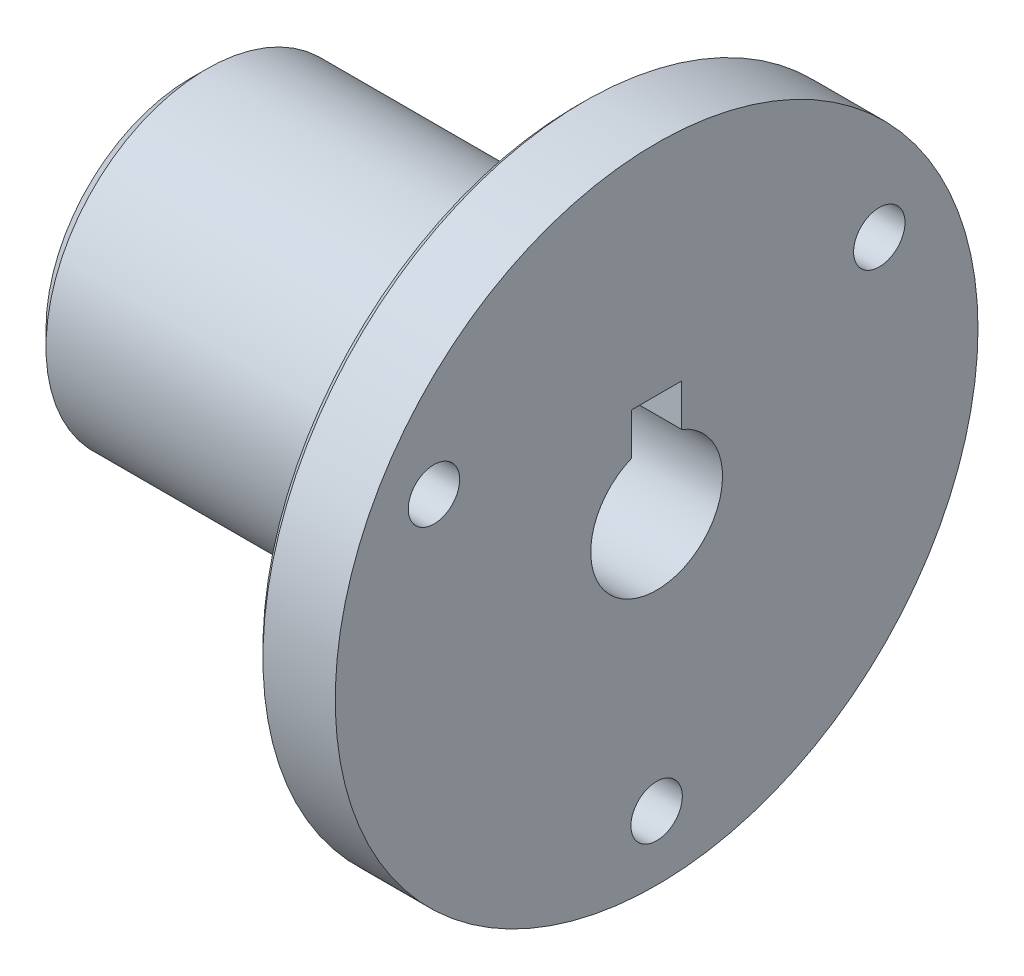
from build123d import *

# Parameters (mm, degrees)
SKETCH_1_R          = 10
EXTRUDE_1_DEPTH     = 24
SKETCH_2_R          = 20
SKETCH_2_R_2        = 1.6
EXTRUDE_2_DEPTH     = 5
CHAMFER_1_SIZE      = 0.5
CHAMFER_2_SIZE      = 1
CHAMFER_3_SIZE      = 0.5
CHAMFER_4_SIZE      = 2
CUT_EXTRUDE_1_DEPTH = 10


with BuildPart() as part:
    # 草图1 → 凸台-拉伸1 (new body)
    with BuildSketch(Plane(origin=(0, 0, 0), x_dir=(0, 0, -1), z_dir=(1, 0, 0))):
        Circle(SKETCH_1_R)
        with BuildLine():
            Line((0, 6.4), (-1.55, 6.4))
            Line((-1.55, 6.4), (-1.55, 3.795721275))
            ThreePointArc((-1.55, 3.795721275), (0, -4.1), (1.55, 3.795721275))
            Line((1.55, 3.795721275), (1.55, 6.4))
            Line((1.55, 6.4), (0, 6.4))
        make_face(mode=Mode.SUBTRACT)
    extrude(amount=EXTRUDE_1_DEPTH)

    # 草图2 → 凸台-拉伸2 (add)
    with BuildSketch(Plane(origin=(24, 0, 0), x_dir=(0, 0, -1), z_dir=(1, 0, 0))):
        Circle(SKETCH_2_R)
        with Locations((-13.856406461, 8)):
            Circle(SKETCH_2_R_2, mode=Mode.SUBTRACT)
        with Locations((13.856406461, 8)):
            Circle(SKETCH_2_R_2, mode=Mode.SUBTRACT)
        with Locations((0, -16)):
            Circle(SKETCH_2_R_2, mode=Mode.SUBTRACT)
    extrude(amount=EXTRUDE_2_DEPTH)

    # 倒角1
    chamfer_1_edges = [part.edges().sort_by_distance(p)[0] for p in [
        (0, -4.1, 0),
    ]]
    chamfer(chamfer_1_edges, length=CHAMFER_1_SIZE)

    # 倒角2
    chamfer_2_edges = [part.edges().sort_by_distance(p)[0] for p in [
        (0, 0, 10),
    ]]
    chamfer(chamfer_2_edges, length=CHAMFER_2_SIZE)

    # 倒角3
    chamfer_3_edges = [part.edges().sort_by_distance(p)[0] for p in [
        (24, 0, 20),
    ]]
    chamfer(chamfer_3_edges, length=CHAMFER_3_SIZE)

    # 倒角4
    chamfer_4_edges = [part.edges().sort_by_distance(p)[0] for p in [
        (24, 0, 10),
    ]]
    chamfer(chamfer_4_edges, length=CHAMFER_4_SIZE)

    # 草图3 → 切除-拉伸1 (cut)
    with BuildSketch(Plane.ZY.offset(-24)):
        with BuildLine():
            Line((0, 6.4), (-1.55, 6.4))
            Line((-1.55, 6.4), (-1.55, 3.795721275))
            ThreePointArc((-1.55, 3.795721275), (0, -4.1), (1.55, 3.795721275))
            Line((1.55, 3.795721275), (1.55, 6.4))
            Line((1.55, 6.4), (0, 6.4))
        make_face()
    extrude(amount=-CUT_EXTRUDE_1_DEPTH, mode=Mode.SUBTRACT)


solid = part.part
